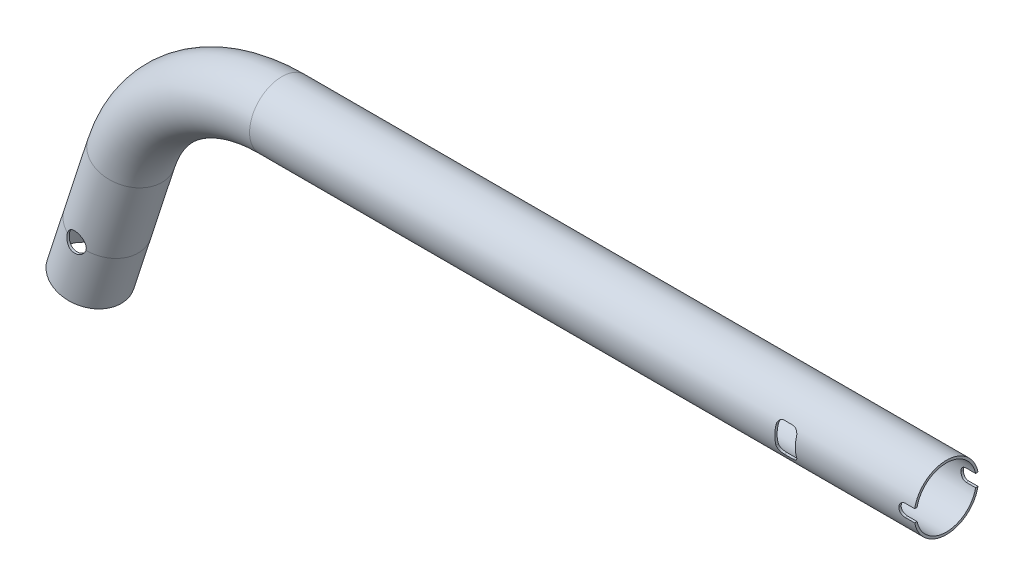
from build123d import *

# Parameters (mm, degrees)
SKETCH3_R               = 11
SKETCH3_R_2             = 10.2
CUT_EXTRUDE1_REACH      = 188.961
SKETCH4_R               = 3.3
SKETCH5_R               = 3.3
CUT_EXTRUDE2_DEPTH      = 187.960827776
CUT_EXTRUDE3_DEPTH      = 187.960827776
CUT_EXTRUDE3_DEPTH_BACK = 187.960827776


with BuildPart() as part:
    # Sweep2: sweep along a path in Sketch1
    with BuildLine(Plane.XY) as sweep2_path:
        Line((135.278349191, 0), (91.278349191, 0))
        Line((91.278349191, 0), (-91.278349191, 0))
        ThreePointArc((-91.278349191, 0), (-123.018752815, -10.313082304), (-142.635401071, -37.313082304))
        Line((-142.635401071, -37.313082304), (-150.721650809, -62.2))
        Line((-150.721650809, -62.2), (-156.505221402, -80))
    # Sketch3 → Sweep2 (sweep)
    with BuildSketch(Plane(origin=(91.278349191, 0, 0), x_dir=(0, 0, -1), z_dir=(1, 0, 0))):
        Circle(SKETCH3_R)
        Circle(SKETCH3_R_2, mode=Mode.SUBTRACT)
    sweep(path=sweep2_path.line)

    # Sketch4 → Cut-Extrude1 (cut, up to next)
    with BuildSketch(Plane.XY, mode=Mode.PRIVATE) as cut_extrude1_sk1:
        with Locations((-150.721650809, -62.2)):
            Circle(SKETCH4_R)
    cut_extrude1_tool1 = extrude(cut_extrude1_sk1.sketch, amount=CUT_EXTRUDE1_REACH, mode=Mode.PRIVATE) & part.part
    # Sketch4 → Cut-Extrude1 (cut, up to next)
    with BuildSketch(Plane.XY, mode=Mode.PRIVATE) as cut_extrude1_sk2:
        with BuildLine():
            Line((135.282015265, 2.1), (135.282015265, -2.1))
            Line((135.282015265, -2.1), (132.082015265, -2.1))
            ThreePointArc((132.082015265, -2.1), (130.667801703, -1.514213562), (130.082015265, -0.1))
            Line((130.082015265, -0.1), (130.082015265, 0.1))
            ThreePointArc((130.082015265, 0.1), (130.667801703, 1.514213562), (132.082015265, 2.1))
            Line((132.082015265, 2.1), (135.282015265, 2.1))
        make_face()
    cut_extrude1_tool2 = extrude(cut_extrude1_sk2.sketch, amount=CUT_EXTRUDE1_REACH, mode=Mode.PRIVATE) & part.part
    # Sketch4 → Cut-Extrude1 (cut, up to next)
    with BuildSketch(Plane.XY, mode=Mode.PRIVATE) as cut_extrude1_sk3:
        with BuildLine():
            Line((89.778349191, -5), (92.778349191, -5))
            ThreePointArc((92.778349191, -5), (94.192562753, -4.414213562), (94.778349191, -3))
            Line((94.778349191, -3), (94.778349191, 3))
            ThreePointArc((94.778349191, 3), (94.192562753, 4.414213562), (92.778349191, 5))
            Line((92.778349191, 5), (89.778349191, 5))
            ThreePointArc((89.778349191, 5), (88.364135629, 4.414213562), (87.778349191, 3))
            Line((87.778349191, 3), (87.778349191, -3))
            ThreePointArc((87.778349191, -3), (88.364135629, -4.414213562), (89.778349191, -5))
        make_face()
    cut_extrude1_tool3 = extrude(cut_extrude1_sk3.sketch, amount=CUT_EXTRUDE1_REACH, mode=Mode.PRIVATE) & part.part
    add(cut_extrude1_tool1.solids().sort_by_distance((-150.721651, -62.2, 0))[0], mode=Mode.SUBTRACT)
    add(cut_extrude1_tool2.solids().sort_by_distance((132.865722, 0, 0))[0], mode=Mode.SUBTRACT)
    add(cut_extrude1_tool3.solids().sort_by_distance((91.278349, 0, 0))[0], mode=Mode.SUBTRACT)

    # Sketch5 → Cut-Extrude2 (cut, through all)
    with BuildSketch(Plane.XY):
        with Locations((-150.721650809, -62.2)):
            Circle(SKETCH5_R)
    extrude(amount=-CUT_EXTRUDE2_DEPTH, mode=Mode.SUBTRACT)

    # Sketch6 → Cut-Extrude3 (cut, two sides: drawn at the far end of the back side and taken through both)
    with BuildSketch(Plane.XY.offset(-CUT_EXTRUDE3_DEPTH_BACK)):
        with BuildLine():
            Line((130.082015265, 0.1), (130.082015265, -0.1))
            ThreePointArc((130.082015265, -0.1), (130.667801703, -1.514213562), (132.082015265, -2.1))
            Line((132.082015265, -2.1), (135.278349191, -2.1))
            Line((135.278349191, -2.1), (135.278349191, 2.1))
            Line((135.278349191, 2.1), (132.082015265, 2.1))
            ThreePointArc((132.082015265, 2.1), (130.667801703, 1.514213562), (130.082015265, 0.1))
        make_face()
    extrude(amount=CUT_EXTRUDE3_DEPTH + CUT_EXTRUDE3_DEPTH_BACK, mode=Mode.SUBTRACT)


solid = part.part
